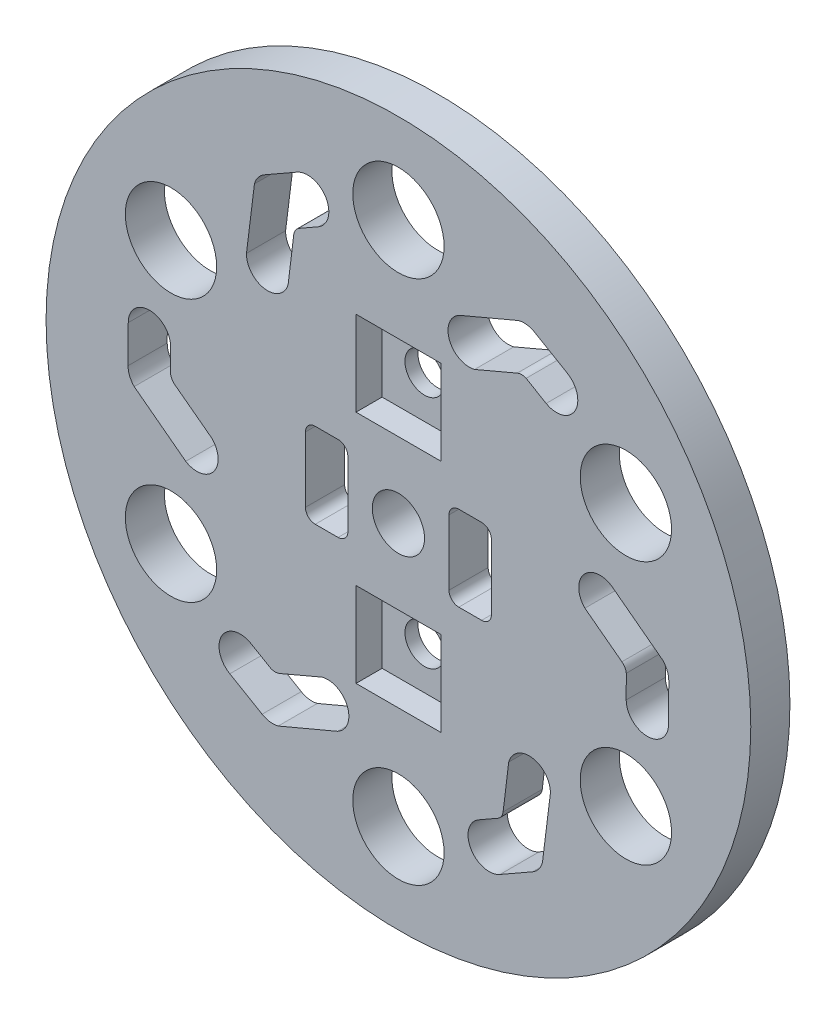
from build123d import *

# Parameters (mm, degrees)
MODEL_R                 = 27
MODEL_R_2               = 1.5
MODEL_R_3               = 3.5
MODEL_R_4               = 2
SALIENTE_EXTRUIR8_DEPTH = 3
CROQUIS2_W              = 6.500000001
CROQUIS2_H              = 6.5
CROQUIS2_W_2            = 6.5
CORTAR_EXTRUIR1_DEPTH   = 2


with BuildPart() as part:
    # Model → Saliente-Extruir8 (new body)
    with BuildSketch(Plane.XY):
        with Locations((215.747807914, 241.952019993)):
            Circle(MODEL_R)
        with Locations((215.747807914, 250.952019993)):
            Circle(MODEL_R_2, mode=Mode.SUBTRACT)
        with BuildLine():
            Line((204.427323855, 228.335080385), (205.96503734, 227.437630632))
            ThreePointArc((205.96503734, 227.437630632), (206.304374517, 227.365476242), (206.644501584, 227.433810378))
            Line((206.644501584, 227.433810378), (209.911276201, 228.82330079))
            ThreePointArc((209.911276201, 228.82330079), (211.836258062, 227.847060547), (211.093778303, 225.820407152))
            Line((211.093778303, 225.820407152), (206.535057881, 223.892649522))
            ThreePointArc((206.535057881, 223.892649522), (205.90217884, 223.854239377), (205.302775922, 224.060945354))
            Line((205.302775922, 224.060945354), (202.827238921, 225.506481172))
            ThreePointArc((202.827238921, 225.506481172), (202.212981782, 227.720823245), (204.427323855, 228.335080385))
        make_face(mode=Mode.SUBTRACT)
        with Locations((198.319382856, 231.889714094)):
            Circle(MODEL_R_3, mode=Mode.SUBTRACT)
        with BuildLine():
            ThreePointArc((208.622807913, 244.452019993), (208.842477828, 244.982350079), (209.372807913, 245.202019993))
            Line((209.372807913, 245.202019993), (211.122807913, 245.202019993))
            ThreePointArc((211.122807913, 245.202019993), (211.653137999, 244.982350079), (211.872807913, 244.452019993))
            Line((211.872807913, 244.452019993), (211.872807913, 239.452019993))
            ThreePointArc((211.872807914, 239.452019993), (211.653137999, 238.921689907), (211.122807913, 238.702019993))
            Line((211.122807913, 238.702019993), (209.372807913, 238.702019993))
            ThreePointArc((209.372807913, 238.702019993), (208.842477828, 238.921689907), (208.622807913, 239.452019993))
            Line((208.622807913, 239.452019993), (208.622807913, 244.452019993))
        make_face(mode=Mode.SUBTRACT)
        with Locations((215.747807914, 221.827408196)):
            Circle(MODEL_R_3, mode=Mode.SUBTRACT)
        with BuildLine():
            Line((221.880181507, 225.339723411), (223.426252534, 226.222697477))
            ThreePointArc((223.426252534, 226.222697477), (223.658408657, 226.480494897), (223.769293093, 226.809220646))
            Line((223.769293093, 226.809220646), (224.199346406, 230.333075658))
            ThreePointArc((224.199346406, 230.333075658), (226.007286187, 231.512038731), (227.391179633, 229.8557057))
            Line((227.391179633, 229.8557057), (226.781306502, 224.94385919))
            ThreePointArc((226.781306502, 224.94385919), (226.498131143, 224.376564791), (226.019417057, 223.960819626))
            Line((226.019417057, 223.960819626), (223.529777815, 222.539709604))
            ThreePointArc((223.529777815, 222.539709604), (221.304972757, 223.114918353), (221.880181507, 225.339723411))
        make_face(mode=Mode.SUBTRACT)
        with BuildLine():
            Line((220.372807913, 245.202019993), (222.122807913, 245.202019993))
            ThreePointArc((222.122807913, 245.202019993), (222.653137999, 244.982350079), (222.872807913, 244.452019993))
            Line((222.872807913, 244.452019993), (222.872807913, 239.452019993))
            ThreePointArc((222.872807914, 239.452019993), (222.653137999, 238.921689907), (222.122807913, 238.702019993))
            Line((222.122807913, 238.702019993), (220.372807913, 238.702019993))
            ThreePointArc((220.372807913, 238.702019993), (219.842477828, 238.921689907), (219.622807913, 239.452019993))
            Line((219.622807913, 239.452019993), (219.622807913, 244.452019993))
            ThreePointArc((219.622807913, 244.452019993), (219.842477828, 244.982350079), (220.372807913, 245.202019993))
        make_face(mode=Mode.SUBTRACT)
        with Locations((233.176232971, 231.889714094)):
            Circle(MODEL_R_3, mode=Mode.SUBTRACT)
        with BuildLine():
            Line((233.200665566, 238.95666302), (233.209023107, 240.737086838))
            ThreePointArc((233.209023107, 240.737086838), (233.101842054, 241.067038649), (232.872599423, 241.327430261))
            Line((232.872599423, 241.327430261), (230.035878119, 243.461794862))
            ThreePointArc((230.035878119, 243.461794862), (229.918836039, 245.616998177), (232.045209243, 245.987318542))
            Line((232.045209243, 245.987318542), (235.994056535, 243.003229662))
            ThreePointArc((235.994056535, 243.003229662), (236.343760216, 242.474345408), (236.464449048, 241.851894265))
            Line((236.464449048, 241.851894265), (236.450346808, 238.985248425))
            ThreePointArc((236.450346808, 238.985248425), (234.839798889, 237.346115101), (233.200665566, 238.95666302))
        make_face(mode=Mode.SUBTRACT)
        with BuildLine():
            Line((198.294950261, 244.947376967), (198.28659272, 243.166953149))
            ThreePointArc((198.28659272, 243.166953149), (198.393773773, 242.837001338), (198.623016404, 242.576609725))
            Line((198.623016404, 242.576609725), (201.459737708, 240.442245125))
            ThreePointArc((201.459737708, 240.442245125), (201.576779788, 238.28704181), (199.450406584, 237.916721445))
            Line((199.450406584, 237.916721445), (195.501559292, 240.900810324))
            ThreePointArc((195.501559292, 240.900810324), (195.151855611, 241.429694579), (195.031166779, 242.052145721))
            Line((195.031166779, 242.052145721), (195.045269019, 244.918791561))
            ThreePointArc((195.045269019, 244.918791561), (196.655816938, 246.557924885), (198.294950261, 244.947376967))
        make_face(mode=Mode.SUBTRACT)
        with Locations((198.319382856, 252.014325892)):
            Circle(MODEL_R_3, mode=Mode.SUBTRACT)
        with BuildLine():
            Line((220.401837524, 258.083632835), (224.960557946, 260.011390465))
            ThreePointArc((224.960557946, 260.011390465), (225.593436987, 260.04980061), (226.192839905, 259.843094633))
            Line((226.192839905, 259.843094633), (228.668376906, 258.397558814))
            ThreePointArc((228.668376906, 258.397558814), (229.282634045, 256.183216741), (227.068291972, 255.568959602))
            Line((227.068291972, 255.568959602), (225.530578487, 256.466409354))
            ThreePointArc((225.530578487, 256.466409354), (225.19124131, 256.538563745), (224.851114243, 256.470229608))
            Line((224.851114243, 256.470229608), (221.584339626, 255.080739197))
            ThreePointArc((221.584339626, 255.080739197), (219.659357765, 256.056979439), (220.401837524, 258.083632835))
        make_face(mode=Mode.SUBTRACT)
        with BuildLine():
            Line((209.61543432, 258.564316575), (208.069363293, 257.681342509))
            ThreePointArc((208.069363293, 257.681342509), (207.83720717, 257.423545089), (207.726322734, 257.094819341))
            Line((207.726322734, 257.094819341), (207.296269421, 253.570964328))
            ThreePointArc((207.296269421, 253.570964328), (205.48832964, 252.392001256), (204.104436194, 254.048334286))
            Line((204.104436194, 254.048334286), (204.714309325, 258.960180796))
            ThreePointArc((204.714309325, 258.960180796), (204.997484684, 259.527475195), (205.47619877, 259.94322036))
            Line((205.47619877, 259.94322036), (207.965838012, 261.364330383))
            ThreePointArc((207.965838012, 261.364330383), (210.19064307, 260.789121633), (209.61543432, 258.564316575))
        make_face(mode=Mode.SUBTRACT)
        with Locations((215.747807914, 241.952019993)):
            Circle(MODEL_R_4, mode=Mode.SUBTRACT)
        with Locations((233.176232971, 252.014325892)):
            Circle(MODEL_R_3, mode=Mode.SUBTRACT)
        with Locations((215.747807914, 262.076631791)):
            Circle(MODEL_R_3, mode=Mode.SUBTRACT)
        with Locations((215.747807914, 232.952019993)):
            Circle(MODEL_R_2, mode=Mode.SUBTRACT)
    extrude(amount=SALIENTE_EXTRUIR8_DEPTH)

    # Croquis2 → Cortar-Extruir1 (cut)
    with BuildSketch(Plane.XY.offset(3)):
        with Locations((215.747807914, 250.952019993)):
            Rectangle(CROQUIS2_W, CROQUIS2_H)
        with Locations((215.747807914, 232.952019993)):
            Rectangle(CROQUIS2_W_2, CROQUIS2_H)
    extrude(amount=-CORTAR_EXTRUIR1_DEPTH, mode=Mode.SUBTRACT)


solid = part.part
